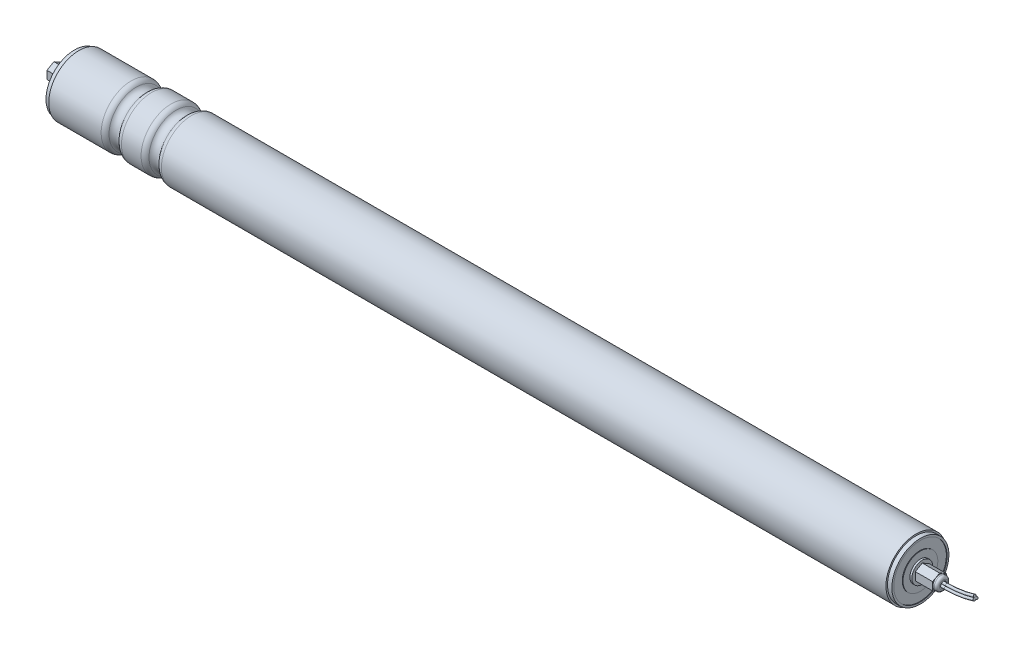
from build123d import *

# Parameters (mm, degrees)
BOSS_EXTRUDE1_DEPTH             = 14.986
BOSS_EXTRUDE2_DEPTH             = 17.018
SKETCH5_OUTSIDE_W               = 190.868
SKETCH5_OUTSIDE_H               = 190.868
SKETCH5_OUTSIDE_R               = 5.334
CUT_EXTRUDE1_DEPTH              = 3.175
FILLET1_R                       = 2.032
BOSS_EXTRUDE3_REACH             = 360.884
SKETCH6_R                       = 24.13
BOSS_EXTRUDE3_DIRECTION_2_REACH = 360.884
SKETCH8_R                       = 2.286
CUT_EXTRUDE2_DEPTH              = 5.08


with BuildPart() as part:
    # Sketch2 → Revolve1 (revolve)
    with BuildSketch(Plane.XY):
        Polygon((-340.407, 0), (-340.407, 8.382), (-338.883, 8.382), (-338.883, 13.97), (-338.375, 13.97), (-338.375, 21.336), (-338.883, 21.336), (-338.883, 22.86), (-335.407, 22.86), (-335.407, 0), align=None)
        Polygon((335.407, 0), (340.407, 0), (340.407, 8.382), (338.883, 8.382), (338.883, 13.97), (338.375, 13.97), (338.375, 21.336), (338.883, 21.336), (338.883, 22.86), (335.407, 22.86), align=None)
    revolve(axis=Axis((-340.407, 0, 0), (-1, 0, 0)))

    # Sketch3 → Boss-Extrude1 (add)
    with BuildSketch(Plane.ZY.offset(340.407)):
        Polygon((0, 6.415804866), (-5.55625, 3.207902433), (-5.55625, -3.207902433), (0, -6.415804866), (5.55625, -3.207902433), (5.55625, 3.207902433), align=None)
    extrude(amount=BOSS_EXTRUDE1_DEPTH)

    # Sketch4 → Boss-Extrude2 (add)
    with BuildSketch(Plane(origin=(340.407, 0, 0), x_dir=(0, 0, -1), z_dir=(1, 0, 0))):
        Polygon((5.55625, 3.207902433), (0, 6.415804866), (-5.55625, 3.207902433), (-5.55625, -3.207902433), (0, -6.415804866), (5.55625, -3.207902433), align=None)
    extrude(amount=BOSS_EXTRUDE2_DEPTH)

    # Sketch5 outside → Cut-Extrude1 (cut)
    with BuildSketch(Plane(origin=(357.425, 0, 0), x_dir=(0, 0, -1), z_dir=(1, 0, 0))):
        Rectangle(SKETCH5_OUTSIDE_W, SKETCH5_OUTSIDE_H)
        Circle(SKETCH5_OUTSIDE_R, mode=Mode.SUBTRACT)
    extrude(amount=-CUT_EXTRUDE1_DEPTH, mode=Mode.SUBTRACT)

    # Fillet1
    fillet1_edges = [part.edges().sort_by_distance(p)[0] for p in [
        (357.425, 0, 5.334),
    ]]
    fillet(fillet1_edges, radius=FILLET1_R)

    # Boss-Extrude3: up to this face of the body (flat: up to its plane)
    boss_extrude3_end = Plane(part.part.faces().sort_by_distance((-335.407, 0, 0))[0])
    # Sketch6 → Boss-Extrude3 (add, up to the picked face)
    with BuildSketch(Plane(origin=(0, 0, 0), x_dir=(0, 0, -1), z_dir=(1, 0, 0)), mode=Mode.PRIVATE) as boss_extrude3_sk1:
        with Locations(Location((0, 0, 0), (0, 0, 90))):
            Circle(SKETCH6_R)
    boss_extrude3_tool1 = split(extrude(boss_extrude3_sk1.sketch, amount=-BOSS_EXTRUDE3_REACH, mode=Mode.PRIVATE), bisect_by=boss_extrude3_end, keep=Keep.BOTH, mode=Mode.PRIVATE)
    add(boss_extrude3_tool1.solids().sort_by(Axis((0, 0, 0), (-1, 0, 0)))[0])

    # Boss-Extrude3 direction 2: up to this face of the body (flat: up to its plane)
    boss_extrude3_direction_2_end = Plane(part.part.faces().sort_by_distance((335.407, 0, 0))[0])
    # Sketch6 → Boss-Extrude3 direction 2 (add, up to the picked face)
    with BuildSketch(Plane(origin=(0, 0, 0), x_dir=(0, 0, -1), z_dir=(1, 0, 0)), mode=Mode.PRIVATE) as boss_extrude3_direction_2_sk1:
        with Locations(Location((0, 0, 0), (0, 0, 90))):
            Circle(SKETCH6_R)
    boss_extrude3_direction_2_tool1 = split(extrude(boss_extrude3_direction_2_sk1.sketch, amount=BOSS_EXTRUDE3_DIRECTION_2_REACH, mode=Mode.PRIVATE), bisect_by=boss_extrude3_direction_2_end, keep=Keep.BOTH, mode=Mode.PRIVATE)
    add(boss_extrude3_direction_2_tool1.solids().sort_by(Axis((0, 0, 0), (1, 0, 0)))[0])

    # Sketch7 → Cut-Revolve1 (revolve, cut)
    with BuildSketch(Plane.XY):
        with BuildLine():
            Line((-293.424933628, 24.13), (-277.153066372, 24.13))
            ThreePointArc((-277.153066372, 24.13), (-279.486205352, 23.519351244), (-281.221033186, 21.844))
            ThreePointArc((-281.221033186, 21.844), (-285.289, 19.558), (-289.356966814, 21.844))
            ThreePointArc((-289.356966814, 21.844), (-291.091794648, 23.519351244), (-293.424933628, 24.13))
        make_face()
        with BuildLine():
            Line((-245.149066372, 24.13), (-261.420933628, 24.13))
            ThreePointArc((-261.420933628, 24.13), (-259.087794648, 23.519351244), (-257.352966814, 21.844))
            ThreePointArc((-257.352966814, 21.844), (-253.285, 19.558), (-249.217033186, 21.844))
            ThreePointArc((-249.217033186, 21.844), (-247.482205352, 23.519351244), (-245.149066372, 24.13))
        make_face()
    revolve(axis=Axis((-342.9, 0, 0), (-1, 0, 0)), mode=Mode.SUBTRACT)

    # Sketch8 → Cut-Extrude2 (cut)
    with BuildSketch(Plane(origin=(357.425, 0, 0), x_dir=(0, 0, -1), z_dir=(1, 0, 0))):
        Circle(SKETCH8_R)
    extrude(amount=-CUT_EXTRUDE2_DEPTH, mode=Mode.SUBTRACT)

    # Sweep1: sweep along a path in Sketch10
    with BuildLine(Plane.XY) as sweep1_path:
        Line((352.345, 0), (359.965, 0))
        ThreePointArc((359.965, 0), (371.528936685, 0.882569293), (382.825, 3.509832852))
    # Sketch9 → Sweep1 (sweep)
    with BuildSketch(Plane(origin=(352.345, 0, 0), x_dir=(0, 0, -1), z_dir=(1, 0, 0))):
        with BuildLine():
            ThreePointArc((-0.693212205, 0.400226253), (-1.869748847, -1.0795), (0, -0.800452506))
            ThreePointArc((0, -0.800452506), (1.869748847, -1.0795), (0.693212205, 0.400226253))
            ThreePointArc((0.693212205, 0.400226253), (0, 2.159), (-0.693212205, 0.400226253))
        make_face()
    sweep(path=sweep1_path.line)


solid = part.part
